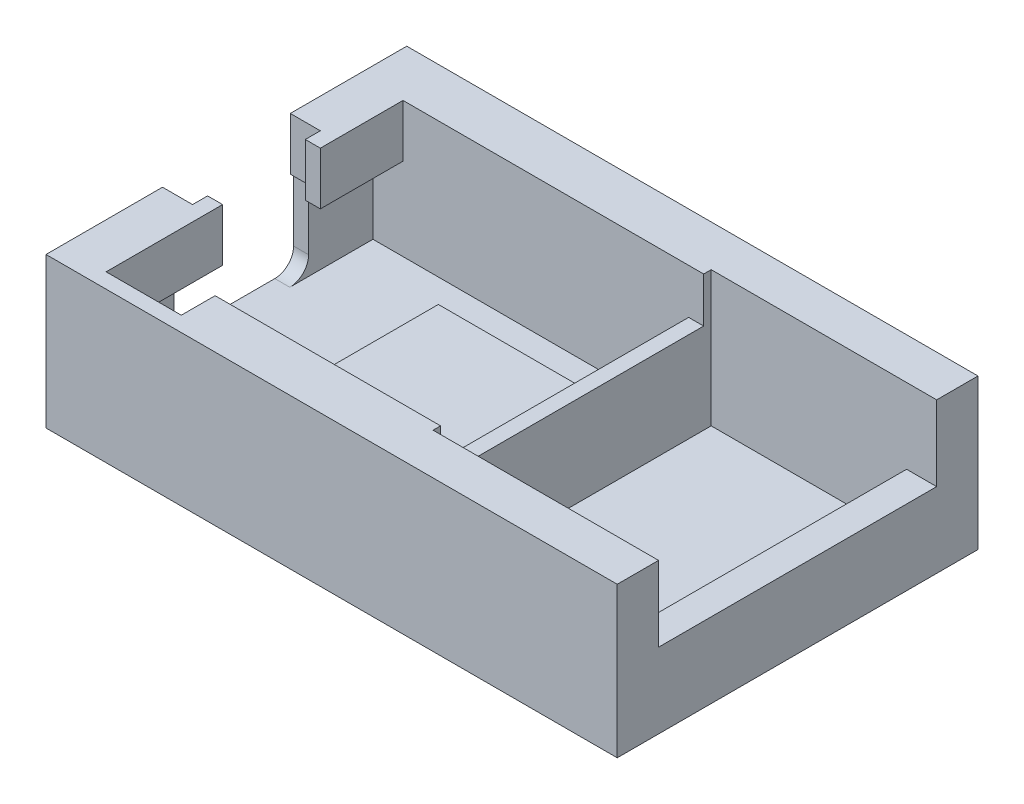
from build123d import *

# Parameters (mm, degrees)
SKETCH1_W           = 40
SKETCH1_H           = 24
BOSS_EXTRUDE1_DEPTH = 1
SKETCH2_W           = 40
SKETCH2_H           = 24
SKETCH2_W_2         = 21
SKETCH2_H_2         = 17.5
SKETCH2_W_3         = 13
SKETCH2_H_3         = 18.5
BOSS_EXTRUDE3_DEPTH = 9
SKETCH3_W           = 1
SKETCH3_H           = 17.5
CUT_EXTRUDE2_DEPTH  = 3
SKETCH4_W           = 10.24
SKETCH4_H           = 11.92
BOSS_EXTRUDE4_DEPTH = 1.21
CUT_EXTRUDE3_DEPTH  = 2
SKETCH8_W           = 4
SKETCH8_H           = 18.5
CUT_EXTRUDE4_DEPTH  = 5
SKETCH11_W          = 24
SKETCH11_H          = 10
CUT_EXTRUDE5_DEPTH  = 2
SKETCH12_W          = 4
SKETCH12_H          = 3
CUT_EXTRUDE6_DEPTH  = 3
BOSS_EXTRUDE5_DEPTH = 3.5
SKETCH14_W          = 1
SKETCH14_H          = 2.25
CUT_EXTRUDE7_DEPTH  = 3


with BuildPart() as part:
    # Sketch1 → Boss-Extrude1 (new body)
    with BuildSketch(Plane(origin=(0, 0, 0), x_dir=(1, 0, 0), z_dir=(0, 1, 0))):
        with Locations((20, 12)):
            Rectangle(SKETCH1_W, SKETCH1_H)
    extrude(amount=BOSS_EXTRUDE1_DEPTH)

    # Sketch2 → Boss-Extrude3 (add)
    with BuildSketch(Plane(origin=(0, 1, 0), x_dir=(1, 0, 0), z_dir=(0, 1, 0))):
        with Locations((20, 12)):
            Rectangle(SKETCH2_W, SKETCH2_H)
        with Locations((11.5, 12)):
            Rectangle(SKETCH2_W_2, SKETCH2_H_2, mode=Mode.SUBTRACT)
        with Locations((29.5, 12)):
            Rectangle(SKETCH2_W_3, SKETCH2_H_3, mode=Mode.SUBTRACT)
    extrude(amount=BOSS_EXTRUDE3_DEPTH)

    # Sketch3 → Cut-Extrude2 (cut)
    with BuildSketch(Plane(origin=(0, 10, 0), x_dir=(1, 0, 0), z_dir=(0, 1, 0))):
        with Locations((22.5, 12)):
            Rectangle(SKETCH3_W, SKETCH3_H)
    extrude(amount=-CUT_EXTRUDE2_DEPTH, mode=Mode.SUBTRACT)

    # Sketch4 → Boss-Extrude4 (add)
    with BuildSketch(Plane(origin=(0, 1, 0), x_dir=(1, 0, 0), z_dir=(0, 1, 0))):
        with Locations((13.26, 12)):
            Rectangle(SKETCH4_W, SKETCH4_H)
    extrude(amount=BOSS_EXTRUDE4_DEPTH)

    # Sketch5 → Cut-Extrude3 (cut)
    with BuildSketch(Plane(origin=(1, 0, 0), x_dir=(0, 0, -1), z_dir=(1, 0, 0))):
        with BuildLine():
            Line((7.53, 2.25), (7.53, 2.96))
            Line((7.53, 2.96), (7.53, 10))
            Line((7.53, 10), (16.47, 10))
            Line((16.47, 10), (16.47, 2.96))
            Line((16.47, 2.96), (16.47, 2.25))
            ThreePointArc((16.47, 2.25), (16.103883476, 1.366116524), (15.22, 1))
            Line((15.22, 1), (8.78, 1))
            ThreePointArc((8.78, 1), (7.896116524, 1.366116524), (7.53, 2.25))
        make_face()
    extrude(amount=-CUT_EXTRUDE3_DEPTH, mode=Mode.SUBTRACT)

    # Sketch8 → Cut-Extrude4 (cut)
    with BuildSketch(Plane(origin=(0, 10, 0), x_dir=(1, 0, 0), z_dir=(0, 1, 0))):
        with Locations((38, 12)):
            Rectangle(SKETCH8_W, SKETCH8_H)
    extrude(amount=-CUT_EXTRUDE4_DEPTH, mode=Mode.SUBTRACT)

    # Sketch11 → Cut-Extrude5 (cut)
    with BuildSketch(Plane(origin=(40, 0, 0), x_dir=(0, 0, -1), z_dir=(1, 0, 0))):
        with Locations((12, 5)):
            Rectangle(SKETCH11_W, SKETCH11_H)
    extrude(amount=-CUT_EXTRUDE5_DEPTH, mode=Mode.SUBTRACT)

    # Sketch12 → Cut-Extrude6 (cut)
    with BuildSketch(Plane(origin=(0, 10, 0), x_dir=(1, 0, 0), z_dir=(0, 1, 0))):
        with Locations((6, 2.5)):
            Rectangle(SKETCH12_W, SKETCH12_H)
    extrude(amount=-CUT_EXTRUDE6_DEPTH, mode=Mode.SUBTRACT)

    # Sketch13 → Boss-Extrude5 (add)
    with BuildSketch(Plane(origin=(0, 10, 0), x_dir=(1, 0, 0), z_dir=(0, 1, 0))):
        Polygon((1, 16.47), (1, 20.75), (3, 20.75), (3, 15.25), (2, 15.25), (2, 16.25), (0, 16.25), (0, 16.47), align=None)
        Polygon((1, 3.25), (3, 3.25), (3, 8.75), (2, 8.75), (2, 7.75), (0, 7.75), (0, 7.53), (1, 7.53), align=None)
    extrude(amount=-BOSS_EXTRUDE5_DEPTH)

    # Sketch14 → Cut-Extrude7 (cut)
    with BuildSketch(Plane(origin=(0, 10, 0), x_dir=(1, 0, 0), z_dir=(0, 1, 0))):
        with Locations((3.5, 2.125)):
            Rectangle(SKETCH14_W, SKETCH14_H)
    extrude(amount=-CUT_EXTRUDE7_DEPTH, mode=Mode.SUBTRACT)


solid = part.part
